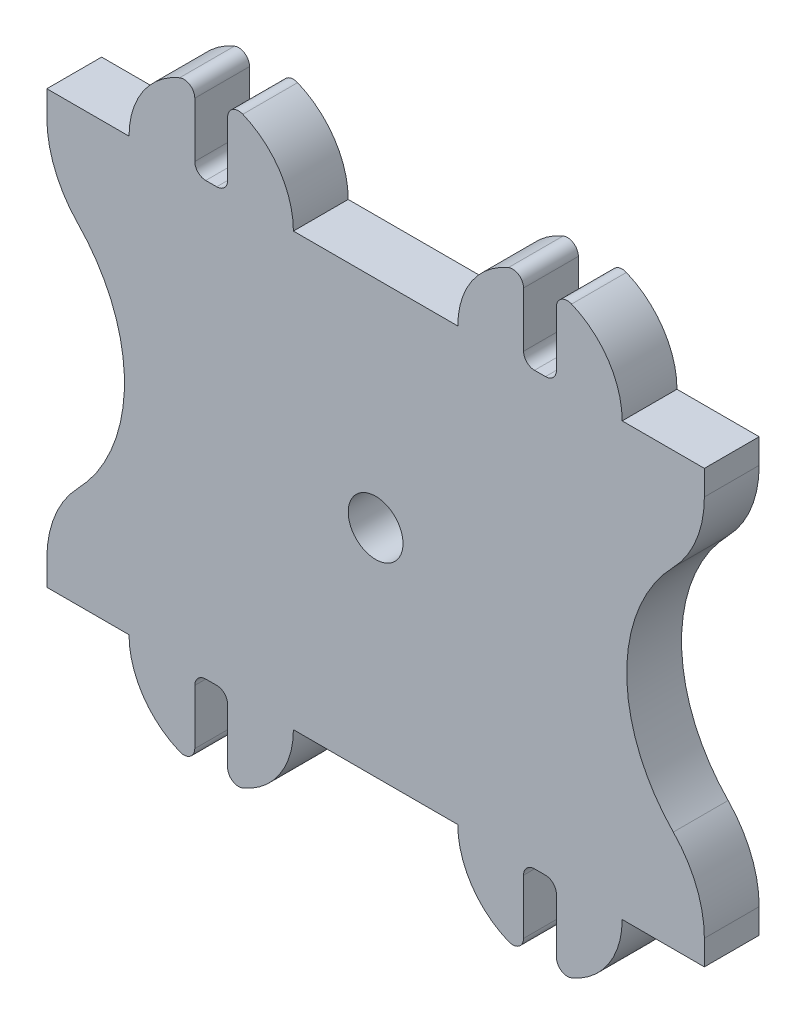
from build123d import *

# Parameters (mm, degrees)
ESQUISSE1_R             = 2.5
BOSS_EXTRU_1_DEPTH      = 5
ENL_V_MAT_EXTRU_1_DEPTH = 41.47085371
CONG_1_R                = 10


with BuildPart() as part:
    # Esquisse1 → Boss.-Extru.1 (new body)
    with BuildSketch(Plane.XY):
        with BuildLine():
            Line((-7.5, -19.7), (7.5, -19.7))
            ThreePointArc((7.5, -19.7), (8.759622792, -23.860251472), (12.115384615, -26.623076923))
            ThreePointArc((12.115384615, -26.623076923), (13.054700196, -26.532050294), (13.5, -25.7))
            Line((13.5, -25.7), (13.5, -20.7))
            ThreePointArc((13.5, -20.7), (13.792893219, -19.992893219), (14.5, -19.7))
            Line((14.5, -19.7), (15.5, -19.7))
            ThreePointArc((15.5, -19.7), (16.207106781, -19.992893219), (16.5, -20.7))
            Line((16.5, -20.7), (16.5, -25.7))
            ThreePointArc((16.5, -25.7), (16.945299804, -26.532050294), (17.884615385, -26.623076923))
            ThreePointArc((17.884615385, -26.623076923), (21.240377208, -23.860251472), (22.5, -19.7))
            Line((22.5, -19.7), (30, -19.7))
            Line((30, -19.7), (30, 19.7))
            Line((30, 19.7), (22.5, 19.7))
            ThreePointArc((22.5, 19.7), (21.240377208, 23.860251472), (17.884615385, 26.623076923))
            ThreePointArc((17.884615385, 26.623076923), (16.945299804, 26.532050294), (16.5, 25.7))
            Line((16.5, 25.7), (16.5, 20.7))
            ThreePointArc((16.5, 20.7), (16.207106781, 19.992893219), (15.5, 19.7))
            Line((15.5, 19.7), (14.5, 19.7))
            ThreePointArc((14.5, 19.7), (13.792893219, 19.992893219), (13.5, 20.7))
            Line((13.5, 20.7), (13.5, 25.7))
            ThreePointArc((13.5, 25.7), (13.054700196, 26.532050294), (12.115384615, 26.623076923))
            ThreePointArc((12.115384615, 26.623076923), (8.759622792, 23.860251472), (7.5, 19.7))
            Line((7.5, 19.7), (-7.5, 19.7))
            ThreePointArc((-7.5, 19.7), (-8.759622792, 23.860251472), (-12.115384615, 26.623076923))
            ThreePointArc((-12.115384615, 26.623076923), (-13.054700196, 26.532050294), (-13.5, 25.7))
            Line((-13.5, 25.7), (-13.5, 20.7))
            ThreePointArc((-13.5, 20.7), (-13.792893219, 19.992893219), (-14.5, 19.7))
            Line((-14.5, 19.7), (-15.5, 19.7))
            ThreePointArc((-15.5, 19.7), (-16.207106781, 19.992893219), (-16.5, 20.7))
            Line((-16.5, 20.7), (-16.5, 25.7))
            ThreePointArc((-16.5, 25.7), (-16.945299804, 26.532050294), (-17.884615385, 26.623076923))
            ThreePointArc((-17.884615385, 26.623076923), (-21.240377208, 23.860251472), (-22.5, 19.7))
            Line((-22.5, 19.7), (-30, 19.7))
            Line((-30, 19.7), (-30, -19.7))
            Line((-30, -19.7), (-22.5, -19.7))
            ThreePointArc((-22.5, -19.7), (-21.240377208, -23.860251472), (-17.884615385, -26.623076923))
            ThreePointArc((-17.884615385, -26.623076923), (-16.945299804, -26.532050294), (-16.5, -25.7))
            Line((-16.5, -25.7), (-16.5, -20.7))
            ThreePointArc((-16.5, -20.7), (-16.207106781, -19.992893219), (-15.5, -19.7))
            Line((-15.5, -19.7), (-14.5, -19.7))
            ThreePointArc((-14.5, -19.7), (-13.792893219, -19.992893219), (-13.5, -20.7))
            Line((-13.5, -20.7), (-13.5, -25.7))
            ThreePointArc((-13.5, -25.7), (-13.054700196, -26.532050294), (-12.115384615, -26.623076923))
            ThreePointArc((-12.115384615, -26.623076923), (-8.759622792, -23.860251472), (-7.5, -19.7))
        make_face()
        Circle(ESQUISSE1_R, mode=Mode.SUBTRACT)
    extrude(amount=BOSS_EXTRU_1_DEPTH)

    # Esquisse2 → Enlèv. mat.-Extru.1 (cut, through all)
    with BuildSketch(Plane.XY.offset(5)):
        with BuildLine():
            Line((-30, 12.741190179), (-30, -12.741190179))
            ThreePointArc((-30, -12.741190179), (-22.915937899, 0), (-30, 12.741190179))
        make_face()
        with BuildLine():
            Line((30, 12.741190179), (30, -12.741190179))
            ThreePointArc((30, -12.741190179), (22.915937899, 0), (30, 12.741190179))
        make_face()
    extrude(amount=-ENL_V_MAT_EXTRU_1_DEPTH, mode=Mode.SUBTRACT)

    # Congé1
    cong_1_edges = [part.edges().sort_by_distance(p)[0] for p in [
        (-30, 12.741190179, 2.5),
        (-30, -12.741190179, 2.5),
        (30, -12.741190179, 2.5),
        (30, 12.741190179, 2.5),
    ]]
    fillet(cong_1_edges, radius=CONG_1_R)


solid = part.part
